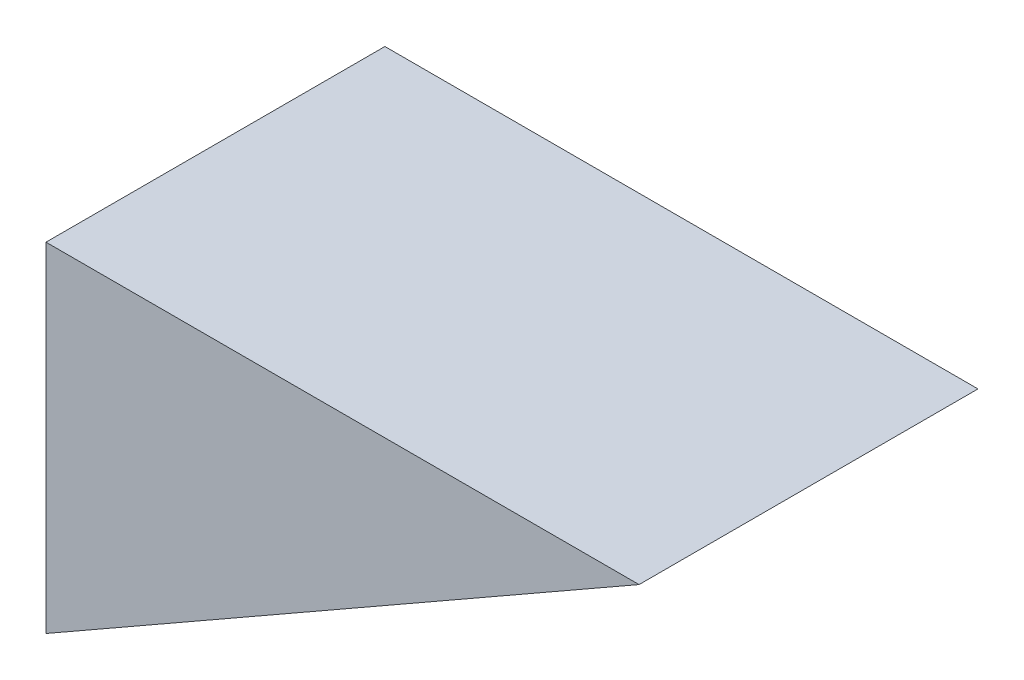
from build123d import *

# Parameters (mm, degrees)
BOSS_EXTRUDE1_DEPTH = 20
SKETCH2_W           = 15.981748592
SKETCH2_H           = 17.990874296
CUT_EXTRUDE1_DEPTH  = 15


with BuildPart() as part:
    # Sketch1 → Boss-Extrude1 (new body)
    with BuildSketch(Plane.XY):
        Polygon((0, 0), (0, 20), (35, 20), align=None)
    extrude(amount=BOSS_EXTRUDE1_DEPTH)

    # Sketch2 → Cut-Extrude1 (cut)
    with BuildSketch(Plane.ZY):
        with Locations((10.013945679, 8.995437148)):
            Rectangle(SKETCH2_W, SKETCH2_H)
    extrude(amount=-CUT_EXTRUDE1_DEPTH, mode=Mode.SUBTRACT)


solid = part.part
